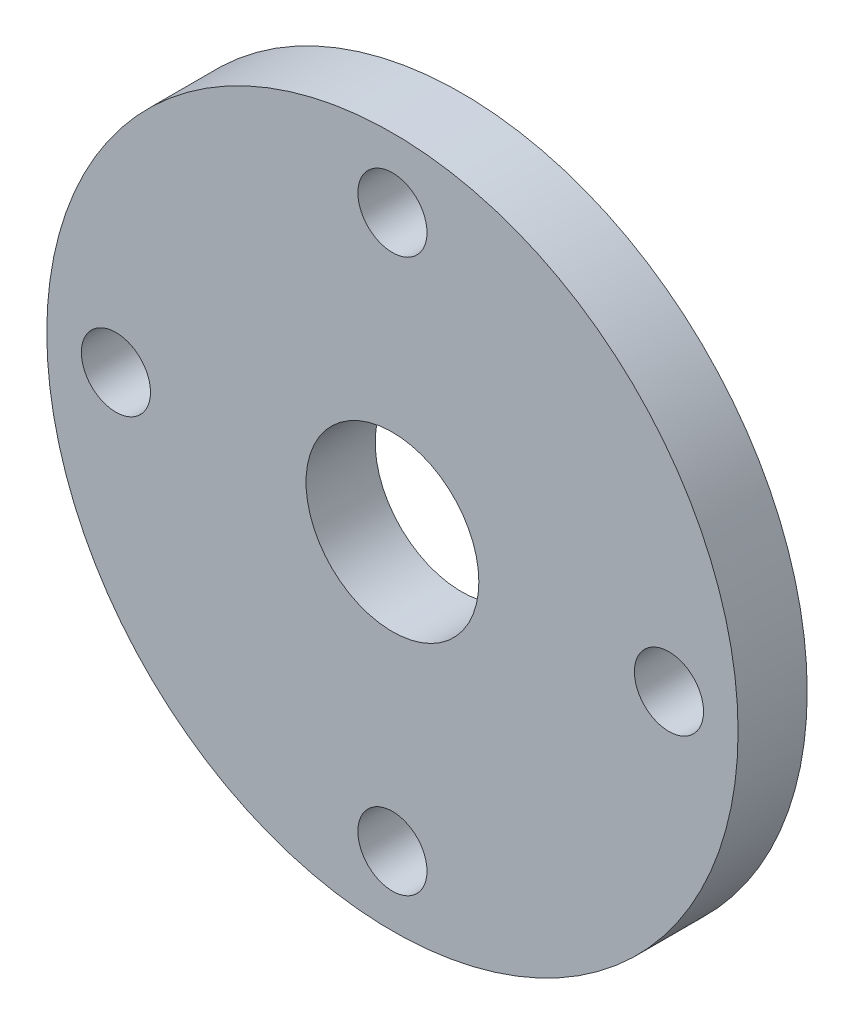
from build123d import *

# Parameters (mm, degrees)
SKETCH_1_R      = 5
SKETCH_1_R_2    = 0.5
SKETCH_1_R_3    = 1.25
EXTRUDE_1_DEPTH = 1


with BuildPart() as part:
    # 草图1 → 凸台-拉伸1 (new body)
    with BuildSketch(Plane.XY):
        Circle(SKETCH_1_R)
        with Locations((-4, 0)):
            Circle(SKETCH_1_R_2, mode=Mode.SUBTRACT)
        Circle(SKETCH_1_R_3, mode=Mode.SUBTRACT)
        with Locations((0, 4)):
            Circle(SKETCH_1_R_2, mode=Mode.SUBTRACT)
        with Locations((4, 0)):
            Circle(SKETCH_1_R_2, mode=Mode.SUBTRACT)
        with Locations((0, -4)):
            Circle(SKETCH_1_R_2, mode=Mode.SUBTRACT)
    extrude(amount=EXTRUDE_1_DEPTH)


solid = part.part
